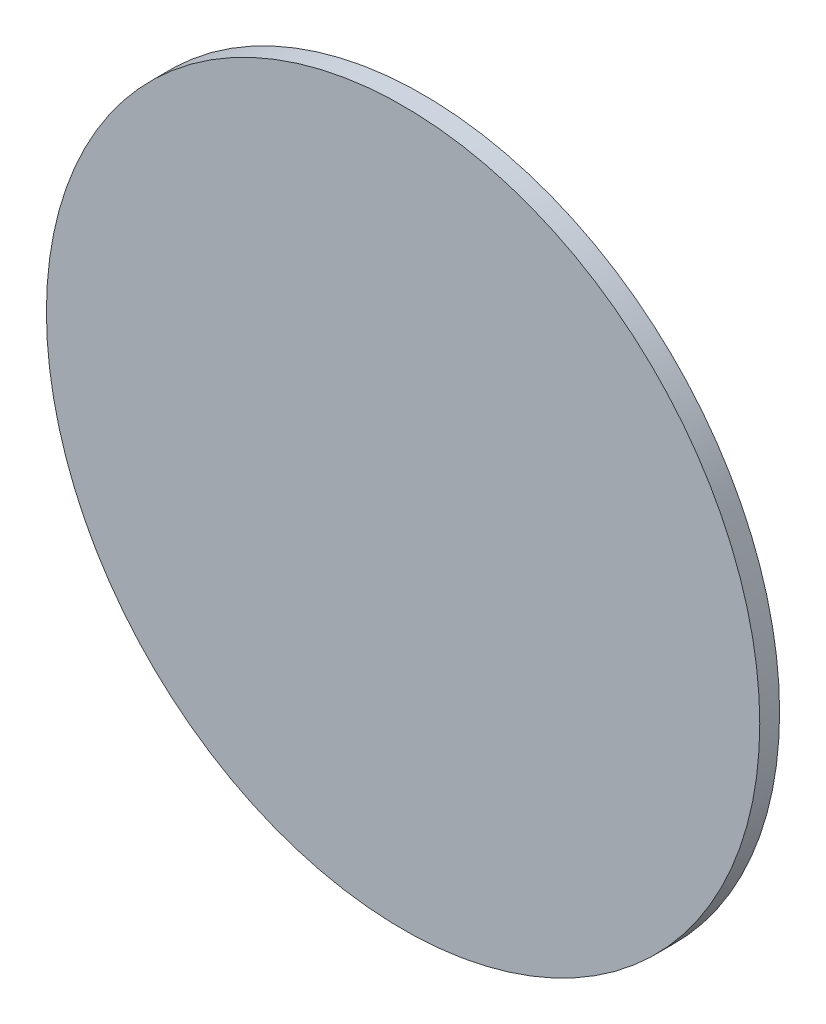
from build123d import *

# Parameters (mm, degrees)
SKETCH1_R           = 90
BOSS_EXTRUDE1_DEPTH = 2.5


with BuildPart() as part:
    # Sketch1 → Boss-Extrude1 (new, symmetric)
    with BuildSketch(Plane.XY):
        Circle(SKETCH1_R)
    extrude(amount=BOSS_EXTRUDE1_DEPTH, both=True)


solid = part.part
